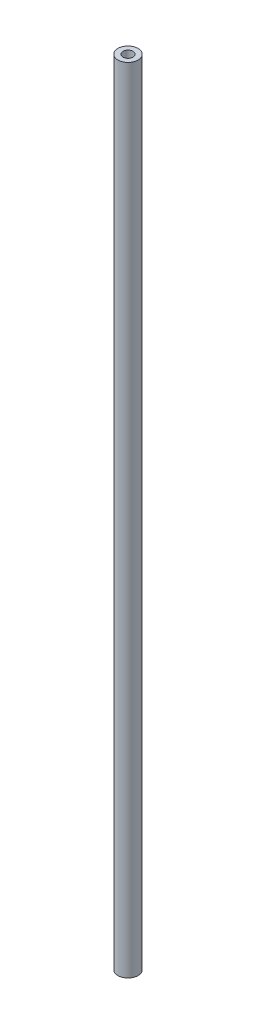
from build123d import *

# Parameters (mm, degrees)
SKETCH1_R           = 3.175
SKETCH1_R_2         = 1.5875
BOSS_EXTRUDE1_DEPTH = 250


with BuildPart() as part:
    # Sketch1 → Boss-Extrude1 (new body)
    with BuildSketch(Plane(origin=(0, 0, 0), x_dir=(1, 0, 0), z_dir=(0, 1, 0))):
        with Locations(Location((0, 0, 0), (0, 0, 270))):
            Circle(SKETCH1_R)
        with Locations(Location((0, 0, 0), (0, 0, 270))):
            Circle(SKETCH1_R_2, mode=Mode.SUBTRACT)
    extrude(amount=BOSS_EXTRUDE1_DEPTH)


solid = part.part
